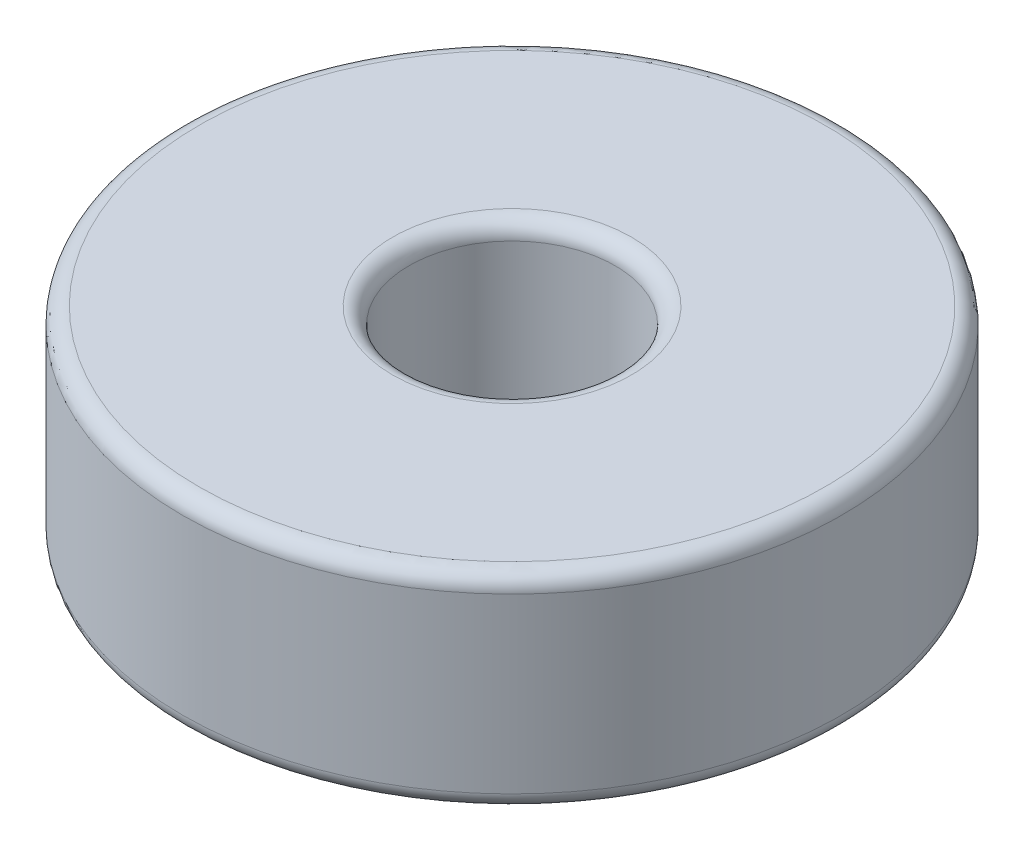
from build123d import *

# Parameters (mm, degrees)
SKETCH1_R           = 8
SKETCH1_R_2         = 2.5
BOSS_EXTRUDE1_DEPTH = 5
FILLET1_R           = 0.4


with BuildPart() as part:
    # Sketch1 → Boss-Extrude1 (new body)
    with BuildSketch(Plane(origin=(0, 0, 0), x_dir=(1, 0, 0), z_dir=(0, 1, 0))):
        with Locations(Location((0, 0, 0), (0, 0, 270))):
            Circle(SKETCH1_R)
        with Locations(Location((0, 0, 0), (0, 0, 270))):
            Circle(SKETCH1_R_2, mode=Mode.SUBTRACT)
    extrude(amount=BOSS_EXTRUDE1_DEPTH)

    # Fillet1
    fillet1_edges = [part.edges().sort_by_distance(p)[0] for p in [
        (0, 0, -8),
        (0, 5, -8),
        (0, 0, -2.5),
        (0, 5, -2.5),
    ]]
    fillet(fillet1_edges, radius=FILLET1_R)


solid = part.part
